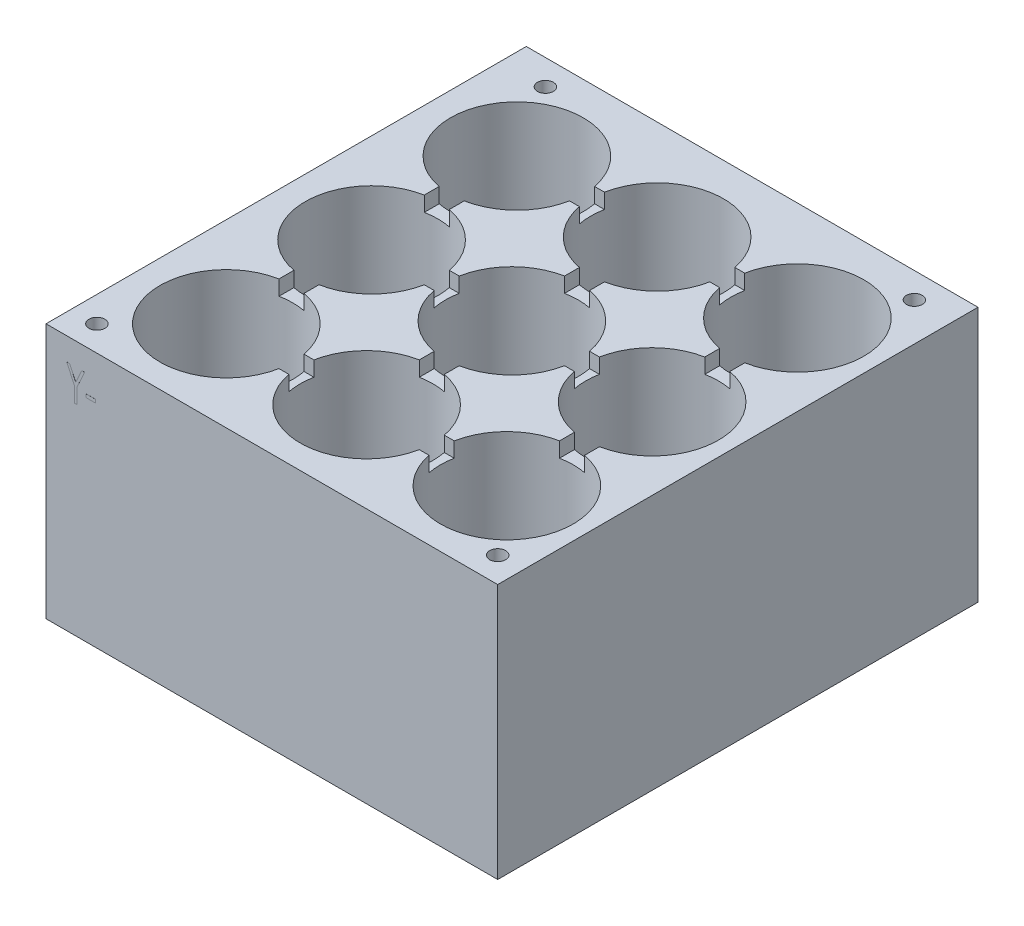
from build123d import *

# Parameters (mm, degrees)
SKETCH1_W                 = 90.17
SKETCH1_H                 = 95.885
BOSS_EXTRUDE1_DEPTH       = 51
SKETCH2_R                 = 1.5875
CUT_EXTRUDE1_DEPTH        = 51
SKETCH3_R                 = 13.25
CUT_EXTRUDE2_DEPTH        = 51
LPATTERN1_COUNT           = 3
LPATTERN1_PITCH           = 29
LPATTERN2_COUNT           = 3
LPATTERN2_PITCH           = 28
LPATTERN2_COPY_1_SKETCH_R = 13.25
LPATTERN2_COPY_1_DEPTH    = 51
LPATTERN2_COPY_2_SKETCH_R = 13.25
LPATTERN2_COPY_2_DEPTH    = 51
LPATTERN2_COPY_3_SKETCH_R = 13.25
LPATTERN2_COPY_3_DEPTH    = 51
LPATTERN2_COPY_4_SKETCH_R = 13.25
LPATTERN2_COPY_4_DEPTH    = 51
SKETCH4_W                 = 1.872435897
SKETCH4_H                 = 0.651282051
BOSS_EXTRUDE2_DEPTH       = 0.01
SKETCH6_W                 = 5
SKETCH6_H                 = 10
CUT_EXTRUDE3_DEPTH        = 3
LPATTERN3_COUNT           = 2
LPATTERN3_PITCH           = 29
LPATTERN4_COUNT           = 3
LPATTERN4_PITCH           = 28
LPATTERN4_COPY_1_SKETCH_W = 5
LPATTERN4_COPY_1_SKETCH_H = 10
LPATTERN4_COPY_1_DEPTH    = 3
LPATTERN4_COPY_2_SKETCH_W = 5
LPATTERN4_COPY_2_SKETCH_H = 10
LPATTERN4_COPY_2_DEPTH    = 3
SKETCH7_W                 = 8.328938764
SKETCH7_H                 = 5
CUT_EXTRUDE4_DEPTH        = 3
LPATTERN5_COUNT           = 2
LPATTERN5_PITCH           = 28
LPATTERN6_COUNT           = 3
LPATTERN6_PITCH           = 29
LPATTERN6_COPY_1_SKETCH_W = 8.328938764
LPATTERN6_COPY_1_SKETCH_H = 5
LPATTERN6_COPY_1_DEPTH    = 3
LPATTERN6_COPY_2_SKETCH_W = 8.328938764
LPATTERN6_COPY_2_SKETCH_H = 5
LPATTERN6_COPY_2_DEPTH    = 3
MIRROR2_COPY_1_SKETCH_W   = 5
MIRROR2_COPY_1_SKETCH_H   = 10
MIRROR2_COPY_1_DEPTH      = 3
MIRROR2_COPY_2_SKETCH_W   = 5
MIRROR2_COPY_2_SKETCH_H   = 10
MIRROR2_COPY_2_DEPTH      = 3
MIRROR2_COPY_3_SKETCH_W   = 5
MIRROR2_COPY_3_SKETCH_H   = 10
MIRROR2_COPY_3_DEPTH      = 3
MIRROR2_COPY_4_SKETCH_W   = 5
MIRROR2_COPY_4_SKETCH_H   = 10
MIRROR2_COPY_4_DEPTH      = 3
MIRROR2_COPY_5_SKETCH_W   = 5
MIRROR2_COPY_5_SKETCH_H   = 10
MIRROR2_COPY_5_DEPTH      = 3
MIRROR2_COPY_6_SKETCH_W   = 8.328938764
MIRROR2_COPY_6_SKETCH_H   = 5
MIRROR2_COPY_6_DEPTH      = 3
MIRROR2_COPY_7_SKETCH_W   = 8.328938764
MIRROR2_COPY_7_SKETCH_H   = 5
MIRROR2_COPY_7_DEPTH      = 3
MIRROR2_COPY_8_SKETCH_W   = 8.328938764
MIRROR2_COPY_8_SKETCH_H   = 5
MIRROR2_COPY_8_DEPTH      = 3
MIRROR2_COPY_9_SKETCH_W   = 8.328938764
MIRROR2_COPY_9_SKETCH_H   = 5
MIRROR2_COPY_9_DEPTH      = 3
MIRROR2_COPY_10_SKETCH_W  = 8.328938764
MIRROR2_COPY_10_SKETCH_H  = 5
MIRROR2_COPY_10_DEPTH     = 3


with BuildPart() as part:
    # Sketch1 → Boss-Extrude1 (new body)
    with BuildSketch(Plane(origin=(0, 0, 0), x_dir=(1, 0, 0), z_dir=(0, 1, 0))):
        Rectangle(SKETCH1_W, SKETCH1_H)
    extrude(amount=BOSS_EXTRUDE1_DEPTH)

    # Sketch2 → Cut-Extrude1 (cut)
    with BuildSketch(Plane(origin=(0, 51, 0), x_dir=(1, 0, 0), z_dir=(0, 1, 0))):
        with Locations(Location((-36.195, 42.8625, 0), (0, 0, 270))):
            Circle(SKETCH2_R)
        with Locations(Location((37.465, 42.8625, 0), (0, 0, 270))):
            Circle(SKETCH2_R)
        with Locations(Location((-40.005, -42.8625, 0), (0, 0, 270))):
            Circle(SKETCH2_R)
        with Locations(Location((40.005, -42.8625, 0), (0, 0, 270))):
            Circle(SKETCH2_R)
    extrude(amount=-CUT_EXTRUDE1_DEPTH, mode=Mode.SUBTRACT)

    # Sketch3 → Cut-Extrude2 (cut)
    with BuildSketch(Plane(origin=(0, 51, 0), x_dir=(1, 0, 0), z_dir=(0, 1, 0))):
        with Locations(Location((-27.085, -29.9425, 0), (0, 0, 270))):
            Circle(SKETCH3_R)
    cut_extrude2 = extrude(amount=-CUT_EXTRUDE2_DEPTH, mode=Mode.SUBTRACT)

    # LPattern1: Cut-Extrude2 ×3
    with Locations(*[(0, 0, -i * LPATTERN1_PITCH) for i in range(1, LPATTERN1_COUNT)]):
        add(cut_extrude2, mode=Mode.SUBTRACT)

    # LPattern2: Cut-Extrude2 ×3
    with Locations(*[(i * LPATTERN2_PITCH, 0, 0) for i in range(1, LPATTERN2_COUNT)]):
        add(cut_extrude2, mode=Mode.SUBTRACT)

    # LPattern2 copy 1 sketch → LPattern2 copy 1 (cut)
    with BuildSketch(Plane(origin=(28, 51, -29), x_dir=(1, 0, 0), z_dir=(0, 1, 0))):
        with Locations(Location((-27.085, -29.9425, 0), (0, 0, 270))):
            Circle(LPATTERN2_COPY_1_SKETCH_R)
    extrude(amount=-LPATTERN2_COPY_1_DEPTH, mode=Mode.SUBTRACT)

    # LPattern2 copy 2 sketch → LPattern2 copy 2 (cut)
    with BuildSketch(Plane(origin=(56, 51, -29), x_dir=(1, 0, 0), z_dir=(0, 1, 0))):
        with Locations(Location((-27.085, -29.9425, 0), (0, 0, 270))):
            Circle(LPATTERN2_COPY_2_SKETCH_R)
    extrude(amount=-LPATTERN2_COPY_2_DEPTH, mode=Mode.SUBTRACT)

    # LPattern2 copy 3 sketch → LPattern2 copy 3 (cut)
    with BuildSketch(Plane(origin=(28, 51, -58), x_dir=(1, 0, 0), z_dir=(0, 1, 0))):
        with Locations(Location((-27.085, -29.9425, 0), (0, 0, 270))):
            Circle(LPATTERN2_COPY_3_SKETCH_R)
    extrude(amount=-LPATTERN2_COPY_3_DEPTH, mode=Mode.SUBTRACT)

    # LPattern2 copy 4 sketch → LPattern2 copy 4 (cut)
    with BuildSketch(Plane(origin=(56, 51, -58), x_dir=(1, 0, 0), z_dir=(0, 1, 0))):
        with Locations(Location((-27.085, -29.9425, 0), (0, 0, 270))):
            Circle(LPATTERN2_COPY_4_SKETCH_R)
    extrude(amount=-LPATTERN2_COPY_4_DEPTH, mode=Mode.SUBTRACT)

    # Sketch4 → Boss-Extrude2 (add)
    with BuildSketch(Plane.XY.offset(47.9425)):
        Polygon((-40.935431089, 46.473214492), (-40.359199118, 46.473214492), (-39.144405448, 43.85663797), (-37.929611778, 46.473214492), (-37.353379807, 46.473214492), (-38.900174678, 43.141754156), (-38.900174678, 40.123214492), (-39.388636217, 40.123214492), (-39.388636217, 43.141754156), align=None)
        with Locations((-36.172931089, 42.565522184)):
            Rectangle(SKETCH4_W, SKETCH4_H)
    extrude(amount=BOSS_EXTRUDE2_DEPTH)

    # Sketch6 → Cut-Extrude3 (cut)
    with BuildSketch(Plane(origin=(0, 51, 0), x_dir=(1, 0, 0), z_dir=(0, 1, 0))):
        with Locations((-27.085, -15.4425)):
            Rectangle(SKETCH6_W, SKETCH6_H)
    cut_extrude3 = extrude(amount=-CUT_EXTRUDE3_DEPTH, mode=Mode.SUBTRACT)

    # LPattern3: Cut-Extrude3 ×2
    with Locations(*[(0, 0, -i * LPATTERN3_PITCH) for i in range(1, LPATTERN3_COUNT)]):
        add(cut_extrude3, mode=Mode.SUBTRACT)

    # LPattern4: Cut-Extrude3 ×3
    with Locations(*[(i * LPATTERN4_PITCH, 0, 0) for i in range(1, LPATTERN4_COUNT)]):
        add(cut_extrude3, mode=Mode.SUBTRACT)

    # LPattern4 copy 1 sketch → LPattern4 copy 1 (cut)
    with BuildSketch(Plane(origin=(28, 51, -29), x_dir=(1, 0, 0), z_dir=(0, 1, 0))):
        with Locations((-27.085, -15.4425)):
            Rectangle(LPATTERN4_COPY_1_SKETCH_W, LPATTERN4_COPY_1_SKETCH_H)
    extrude(amount=-LPATTERN4_COPY_1_DEPTH, mode=Mode.SUBTRACT)

    # LPattern4 copy 2 sketch → LPattern4 copy 2 (cut)
    with BuildSketch(Plane(origin=(56, 51, -29), x_dir=(1, 0, 0), z_dir=(0, 1, 0))):
        with Locations((-27.085, -15.4425)):
            Rectangle(LPATTERN4_COPY_2_SKETCH_W, LPATTERN4_COPY_2_SKETCH_H)
    extrude(amount=-LPATTERN4_COPY_2_DEPTH, mode=Mode.SUBTRACT)

    # Sketch7 → Cut-Extrude4 (cut)
    with BuildSketch(Plane(origin=(0, 51, 0), x_dir=(1, 0, 0), z_dir=(0, 1, 0))):
        with Locations((-13.085, -29.9425)):
            Rectangle(SKETCH7_W, SKETCH7_H)
    cut_extrude4 = extrude(amount=-CUT_EXTRUDE4_DEPTH, mode=Mode.SUBTRACT)

    # LPattern5: Cut-Extrude4 ×2
    with Locations(*[(i * LPATTERN5_PITCH, 0, 0) for i in range(1, LPATTERN5_COUNT)]):
        add(cut_extrude4, mode=Mode.SUBTRACT)

    # LPattern6: Cut-Extrude4 ×3
    with Locations(*[(0, 0, -i * LPATTERN6_PITCH) for i in range(1, LPATTERN6_COUNT)]):
        add(cut_extrude4, mode=Mode.SUBTRACT)

    # LPattern6 copy 1 sketch → LPattern6 copy 1 (cut)
    with BuildSketch(Plane(origin=(28, 51, -29), x_dir=(1, 0, 0), z_dir=(0, 1, 0))):
        with Locations((-13.085, -29.9425)):
            Rectangle(LPATTERN6_COPY_1_SKETCH_W, LPATTERN6_COPY_1_SKETCH_H)
    extrude(amount=-LPATTERN6_COPY_1_DEPTH, mode=Mode.SUBTRACT)

    # LPattern6 copy 2 sketch → LPattern6 copy 2 (cut)
    with BuildSketch(Plane(origin=(28, 51, -58), x_dir=(1, 0, 0), z_dir=(0, 1, 0))):
        with Locations((-13.085, -29.9425)):
            Rectangle(LPATTERN6_COPY_2_SKETCH_W, LPATTERN6_COPY_2_SKETCH_H)
    extrude(amount=-LPATTERN6_COPY_2_DEPTH, mode=Mode.SUBTRACT)

    # Mirror2: Cut-Extrude3, Cut-Extrude4 across plane
    add(cut_extrude3.mirror(Plane.ZX.offset(25.5)), mode=Mode.SUBTRACT)
    add(cut_extrude4.mirror(Plane.ZX.offset(25.5)), mode=Mode.SUBTRACT)

    # Mirror2 copy 1 sketch → Mirror2 copy 1 (cut)
    with BuildSketch(Plane(origin=(0, 0, -29), x_dir=(1, 0, 0), z_dir=(0, -1, 0))):
        with Locations((-27.085, 15.4425)):
            Rectangle(MIRROR2_COPY_1_SKETCH_W, MIRROR2_COPY_1_SKETCH_H)
    extrude(amount=-MIRROR2_COPY_1_DEPTH, mode=Mode.SUBTRACT)

    # Mirror2 copy 2 sketch → Mirror2 copy 2 (cut)
    with BuildSketch(Plane(origin=(28, 0, 0), x_dir=(1, 0, 0), z_dir=(0, -1, 0))):
        with Locations((-27.085, 15.4425)):
            Rectangle(MIRROR2_COPY_2_SKETCH_W, MIRROR2_COPY_2_SKETCH_H)
    extrude(amount=-MIRROR2_COPY_2_DEPTH, mode=Mode.SUBTRACT)

    # Mirror2 copy 3 sketch → Mirror2 copy 3 (cut)
    with BuildSketch(Plane(origin=(56, 0, 0), x_dir=(1, 0, 0), z_dir=(0, -1, 0))):
        with Locations((-27.085, 15.4425)):
            Rectangle(MIRROR2_COPY_3_SKETCH_W, MIRROR2_COPY_3_SKETCH_H)
    extrude(amount=-MIRROR2_COPY_3_DEPTH, mode=Mode.SUBTRACT)

    # Mirror2 copy 4 sketch → Mirror2 copy 4 (cut)
    with BuildSketch(Plane(origin=(28, 0, -29), x_dir=(1, 0, 0), z_dir=(0, -1, 0))):
        with Locations((-27.085, 15.4425)):
            Rectangle(MIRROR2_COPY_4_SKETCH_W, MIRROR2_COPY_4_SKETCH_H)
    extrude(amount=-MIRROR2_COPY_4_DEPTH, mode=Mode.SUBTRACT)

    # Mirror2 copy 5 sketch → Mirror2 copy 5 (cut)
    with BuildSketch(Plane(origin=(56, 0, -29), x_dir=(1, 0, 0), z_dir=(0, -1, 0))):
        with Locations((-27.085, 15.4425)):
            Rectangle(MIRROR2_COPY_5_SKETCH_W, MIRROR2_COPY_5_SKETCH_H)
    extrude(amount=-MIRROR2_COPY_5_DEPTH, mode=Mode.SUBTRACT)

    # Mirror2 copy 6 sketch → Mirror2 copy 6 (cut)
    with BuildSketch(Plane(origin=(28, 0, 0), x_dir=(1, 0, 0), z_dir=(0, -1, 0))):
        with Locations((-13.085, 29.9425)):
            Rectangle(MIRROR2_COPY_6_SKETCH_W, MIRROR2_COPY_6_SKETCH_H)
    extrude(amount=-MIRROR2_COPY_6_DEPTH, mode=Mode.SUBTRACT)

    # Mirror2 copy 7 sketch → Mirror2 copy 7 (cut)
    with BuildSketch(Plane(origin=(0, 0, -29), x_dir=(1, 0, 0), z_dir=(0, -1, 0))):
        with Locations((-13.085, 29.9425)):
            Rectangle(MIRROR2_COPY_7_SKETCH_W, MIRROR2_COPY_7_SKETCH_H)
    extrude(amount=-MIRROR2_COPY_7_DEPTH, mode=Mode.SUBTRACT)

    # Mirror2 copy 8 sketch → Mirror2 copy 8 (cut)
    with BuildSketch(Plane(origin=(0, 0, -58), x_dir=(1, 0, 0), z_dir=(0, -1, 0))):
        with Locations((-13.085, 29.9425)):
            Rectangle(MIRROR2_COPY_8_SKETCH_W, MIRROR2_COPY_8_SKETCH_H)
    extrude(amount=-MIRROR2_COPY_8_DEPTH, mode=Mode.SUBTRACT)

    # Mirror2 copy 9 sketch → Mirror2 copy 9 (cut)
    with BuildSketch(Plane(origin=(28, 0, -29), x_dir=(1, 0, 0), z_dir=(0, -1, 0))):
        with Locations((-13.085, 29.9425)):
            Rectangle(MIRROR2_COPY_9_SKETCH_W, MIRROR2_COPY_9_SKETCH_H)
    extrude(amount=-MIRROR2_COPY_9_DEPTH, mode=Mode.SUBTRACT)

    # Mirror2 copy 10 sketch → Mirror2 copy 10 (cut)
    with BuildSketch(Plane(origin=(28, 0, -58), x_dir=(1, 0, 0), z_dir=(0, -1, 0))):
        with Locations((-13.085, 29.9425)):
            Rectangle(MIRROR2_COPY_10_SKETCH_W, MIRROR2_COPY_10_SKETCH_H)
    extrude(amount=-MIRROR2_COPY_10_DEPTH, mode=Mode.SUBTRACT)


solid = part.part
